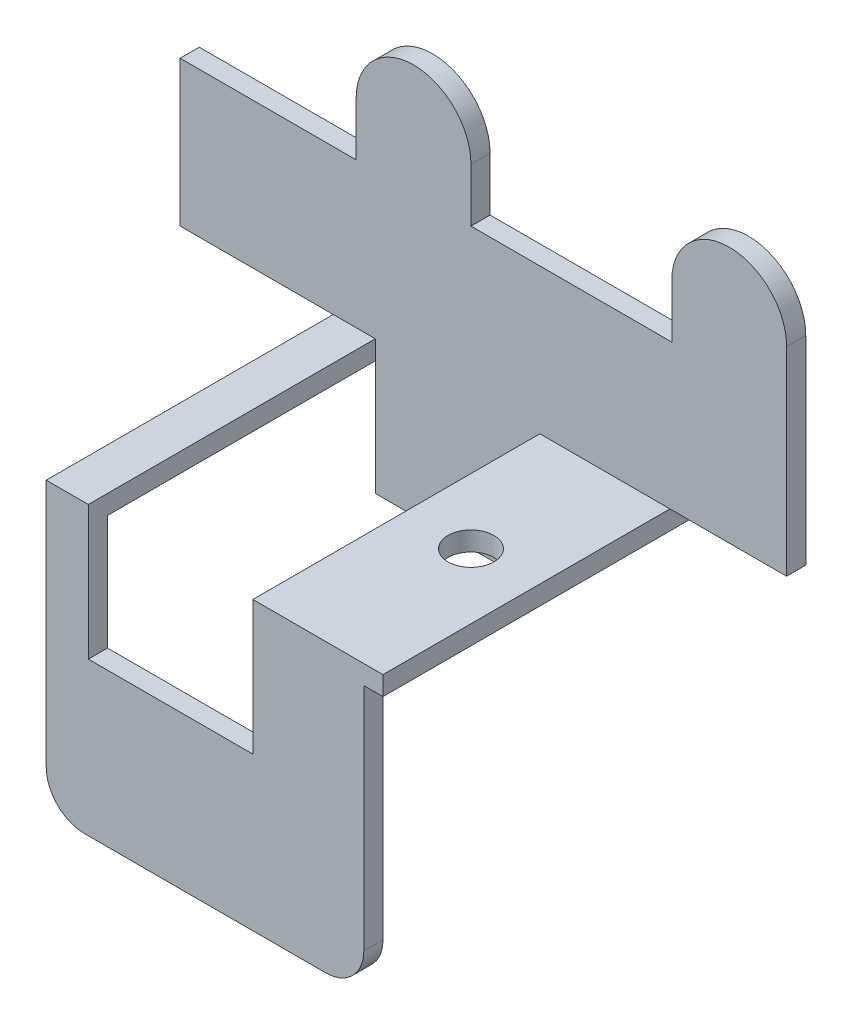
from build123d import *

# Parameters (mm, degrees)
BOSS_EXTRUDE1_DEPTH = 1.27
SKETCH4_W           = 8.636
SKETCH4_H           = 1.27
SKETCH4_W_2         = 2.794
BOSS_EXTRUDE2_DEPTH = 20.32
SKETCH5_W           = 2.794
SKETCH5_H           = 1.27
SKETCH5_W_2         = 7.366
BOSS_EXTRUDE3_DEPTH = 7.62
BOSS_EXTRUDE4_DEPTH = 1.27
SKETCH7_R           = 1.524
CUT_EXTRUDE1_DEPTH  = 49.663543079


with BuildPart() as part:
    # Sketch1 → Boss-Extrude1 (new body)
    with BuildSketch(Plane.XY):
        with BuildLine():
            Line((0, 0), (0, 9.652))
            Line((0, 9.652), (11.684, 9.652))
            Line((11.684, 9.652), (11.684, 13.208))
            ThreePointArc((11.684, 13.208), (15.494, 17.018), (19.304, 13.208))
            Line((19.304, 13.208), (19.304, 9.652))
            Line((19.304, 9.652), (32.639, 9.652))
            Line((32.639, 9.652), (32.639, 13.208))
            ThreePointArc((32.639, 13.208), (36.449, 17.018), (40.259, 13.208))
            Line((40.259, 13.208), (40.259, 9.652))
            Line((40.259, 9.652), (40.259, 0))
            Line((40.259, 0), (23.876, 0))
            Line((23.876, 0), (23.876, -8.89))
            Line((23.876, -8.89), (12.954, -8.89))
            Line((12.954, -8.89), (12.954, 0))
            Line((12.954, 0), (0, 0))
        make_face()
    extrude(amount=BOSS_EXTRUDE1_DEPTH)

    # Sketch4 → Boss-Extrude2 (add)
    with BuildSketch(Plane.XY):
        with Locations((28.194, -0.635)):
            Rectangle(SKETCH4_W, SKETCH4_H)
        with Locations((11.557, -0.635)):
            Rectangle(SKETCH4_W_2, SKETCH4_H)
    extrude(amount=BOSS_EXTRUDE2_DEPTH)

    # Sketch5 → Boss-Extrude3 (add)
    with BuildSketch(Plane.XZ.offset(1.27)):
        with Locations((11.557, 19.685)):
            Rectangle(SKETCH5_W, SKETCH5_H)
        with Locations((27.559, 19.685)):
            Rectangle(SKETCH5_W_2, SKETCH5_H)
    extrude(amount=BOSS_EXTRUDE3_DEPTH)

    # Sketch6 → Boss-Extrude4 (add)
    with BuildSketch(Plane(origin=(0, 0, 19.05), x_dir=(-1, 0, 0), z_dir=(0, 0, -1))):
        with BuildLine():
            Line((-10.16, -8.89), (-31.242, -8.89))
            Line((-31.242, -8.89), (-31.242, -16.51))
            ThreePointArc((-31.242, -16.51), (-30.498051224, -18.306051224), (-28.702, -19.05))
            Line((-28.702, -19.05), (-12.7, -19.05))
            ThreePointArc((-12.7, -19.05), (-10.903948776, -18.306051224), (-10.16, -16.51))
            Line((-10.16, -16.51), (-10.16, -8.89))
        make_face()
    extrude(amount=-BOSS_EXTRUDE4_DEPTH)

    # Sketch7 → Cut-Extrude1 (cut, through all)
    with BuildSketch(Plane.XZ.offset(1.27)):
        with Locations(Location((28.194, 10.16, 0), (0, 0, 270))):
            Circle(SKETCH7_R)
    extrude(amount=-CUT_EXTRUDE1_DEPTH, mode=Mode.SUBTRACT)


solid = part.part
